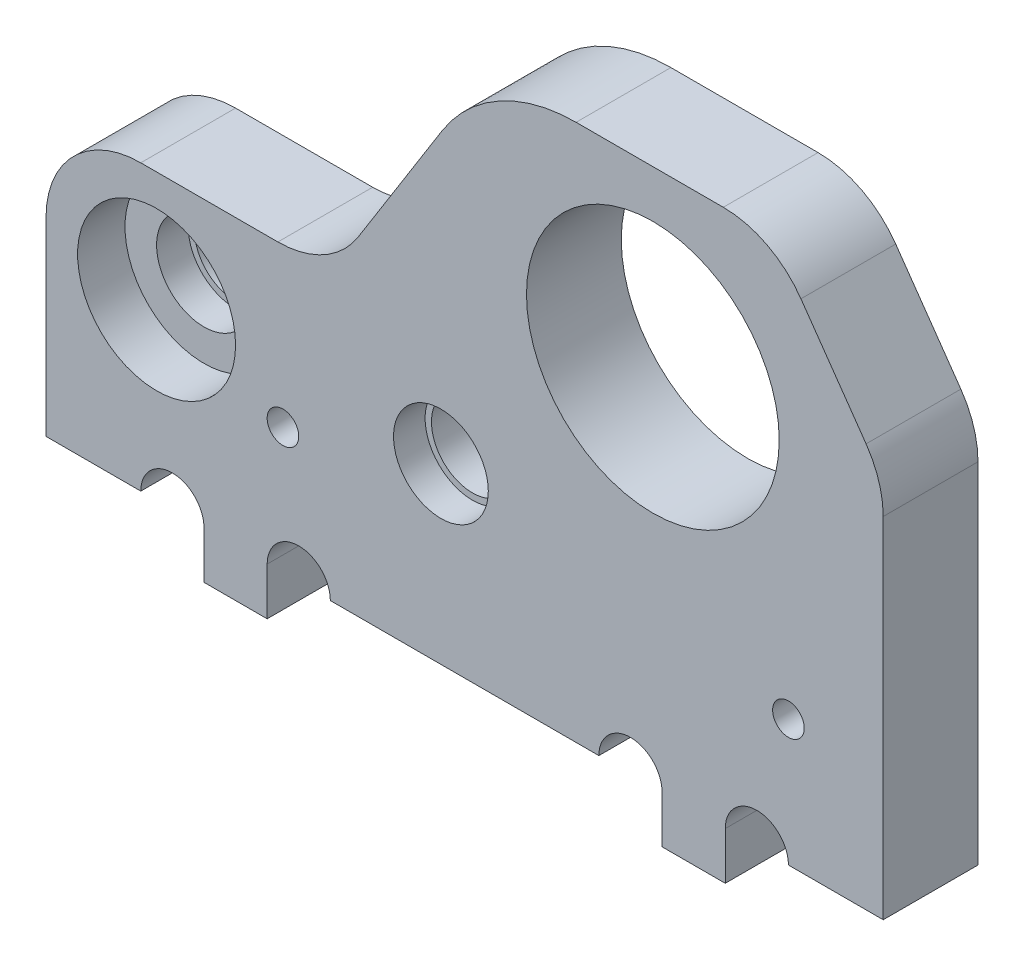
from build123d import *

# Parameters (mm, degrees)
SKETCH1_W                            = 26.5
SKETCH1_H                            = 6
BOSS_EXTRUDE1_DEPTH                  = 17
SKETCH2_R                            = 1.5
CUT_EXTRUDE1_DEPTH                   = 1
SKETCH3_R                            = 1.3
CUT_EXTRUDE2_DEPTH                   = 32.878676259
SKETCH4_R                            = 4
CUT_EXTRUDE3_DEPTH                   = 33.050741021
SKETCH5_R                            = 2.5
CUT_EXTRUDE4_DEPTH                   = 1.5
SKETCH6_R                            = 1.5
CUT_EXTRUDE8_DEPTH                   = 1
SKETCH7_R                            = 1.3
CUT_EXTRUDE9_DEPTH                   = 32.678068123
CUT_EXTRUDE10_START                  = -1
SKETCH8_R                            = 2.5
CUT_EXTRUDE10_DEPTH                  = 1
CUT_EXTRUDE11_START                  = -1
SKETCH9_R                            = 1.5
CUT_EXTRUDE11_DEPTH                  = 1
SKETCH10_R                           = 5.5
SKETCH10_R_2                         = 4
BOSS_EXTRUDE2_DEPTH                  = 3.5
SKETCH11_R                           = 3
SKETCH11_R_2                         = 1.3
BOSS_EXTRUDE4_DEPTH                  = 2
CUT_EXTRUDE12_START                  = -1
SKETCH12_R                           = 1.5
CUT_EXTRUDE12_DEPTH                  = 1
SKETCH17_W                           = 2
SKETCH17_H                           = 6
BOSS_EXTRUDE6_DEPTH                  = 1.5
SKETCH18_R                           = 1
CUT_EXTRUDE17_DEPTH                  = 33.050741021
CHAMFER2_SIZE                        = 5
CHAMFER2_SIZE2                       = 3.5
FILLET11_R                           = 3
BOSS_EXTRUDE7_DEPTH                  = 2
CUT_EXTRUDE19_DEPTH                  = 33.050741021
FILLET13_R                           = 5
FILLET14_R                           = 3
FILLET15_R                           = 3
SKIZZE1_R                            = 0.5
SCHNITT_LINEAR_AUSTRAGEN1_DEPTH      = 33.050741021
SCHNITT_LINEAR_AUSTRAGEN2_DEPTH      = 31.409702399
SCHNITT_LINEAR_AUSTRAGEN2_DEPTH_BACK = 31.409702399
SKIZZE2_W                            = 26.5
SKIZZE2_H                            = 6.5


with BuildPart() as part:
    # Sketch1 → Boss-Extrude1 (new body)
    with BuildSketch(Plane(origin=(0, 0, 0), x_dir=(1, 0, 0), z_dir=(0, 1, 0))):
        with Locations((13.25, 3)):
            Rectangle(SKETCH1_W, SKETCH1_H)
    extrude(amount=BOSS_EXTRUDE1_DEPTH)

    # Sketch2 → Cut-Extrude1 (cut)
    with BuildSketch(Plane.XY):
        with Locations((12.5, 5.5)):
            Circle(SKETCH2_R)
    extrude(amount=-CUT_EXTRUDE1_DEPTH, mode=Mode.SUBTRACT)

    # Sketch3 → Cut-Extrude2 (cut, through all)
    with BuildSketch(Plane.XY.offset(-1)):
        with Locations((12.5, 5.5)):
            Circle(SKETCH3_R)
    extrude(amount=-CUT_EXTRUDE2_DEPTH, mode=Mode.SUBTRACT)

    # Sketch4 → Cut-Extrude3 (cut, through all)
    with BuildSketch(Plane.XY):
        with Locations((19.208203932, 11.5)):
            Circle(SKETCH4_R)
    extrude(amount=-CUT_EXTRUDE3_DEPTH, mode=Mode.SUBTRACT)

    # Sketch5 → Cut-Extrude4 (cut)
    with BuildSketch(Plane.XY):
        with Locations((3.5, 5.5)):
            Circle(SKETCH5_R)
    extrude(amount=-CUT_EXTRUDE4_DEPTH, mode=Mode.SUBTRACT)

    # Sketch6 → Cut-Extrude8 (cut)
    with BuildSketch(Plane.XY.offset(-1.5)):
        with Locations((3.5, 5.5)):
            Circle(SKETCH6_R)
    extrude(amount=-CUT_EXTRUDE8_DEPTH, mode=Mode.SUBTRACT)

    # Sketch7 → Cut-Extrude9 (cut, through all)
    with BuildSketch(Plane.XY.offset(-2.5)):
        with Locations((3.5, 5.5)):
            Circle(SKETCH7_R)
    extrude(amount=-CUT_EXTRUDE9_DEPTH, mode=Mode.SUBTRACT)

    # Sketch8 → Cut-Extrude10 (cut)
    with BuildSketch(Plane(origin=(0, 0, -6), x_dir=(-1, 0, 0), z_dir=(0, 0, -1)).offset(CUT_EXTRUDE10_START)):
        with Locations(Location((-3.5, 5.5, 0), (0, 0, 180))):
            Circle(SKETCH8_R)
    extrude(amount=CUT_EXTRUDE10_DEPTH, mode=Mode.SUBTRACT)

    # Sketch9 → Cut-Extrude11 (cut)
    with BuildSketch(Plane(origin=(0, 0, -5), x_dir=(-1, 0, 0), z_dir=(0, 0, -1)).offset(CUT_EXTRUDE11_START)):
        with Locations(Location((-3.5, 5.5, 0), (0, 0, 180))):
            Circle(SKETCH9_R)
    extrude(amount=CUT_EXTRUDE11_DEPTH, mode=Mode.SUBTRACT)

    # Sketch10 → Boss-Extrude2 (add)
    with BuildSketch(Plane(origin=(0, 0, -6), x_dir=(-1, 0, 0), z_dir=(0, 0, -1))):
        with Locations(Location((-19.208203932, 11.5, 0), (0, 0, 90))):
            Circle(SKETCH10_R)
        with Locations(Location((-19.208203932, 11.5, 0), (0, 0, 180))):
            Circle(SKETCH10_R_2, mode=Mode.SUBTRACT)
    extrude(amount=BOSS_EXTRUDE2_DEPTH)

    # Sketch11 → Boss-Extrude4 (add)
    with BuildSketch(Plane(origin=(0, 0, -6), x_dir=(-1, 0, 0), z_dir=(0, 0, -1))):
        with Locations(Location((-12.5, 5.5, 0), (0, 0, 180))):
            Circle(SKETCH11_R)
        with Locations(Location((-12.5, 5.5, 0), (0, 0, 180))):
            Circle(SKETCH11_R_2, mode=Mode.SUBTRACT)
    extrude(amount=BOSS_EXTRUDE4_DEPTH)

    # Sketch12 → Cut-Extrude12 (cut)
    with BuildSketch(Plane(origin=(0, 0, -8), x_dir=(-1, 0, 0), z_dir=(0, 0, -1)).offset(CUT_EXTRUDE12_START)):
        with Locations(Location((-12.5, 5.5, 0), (0, 0, 180))):
            Circle(SKETCH12_R)
    extrude(amount=CUT_EXTRUDE12_DEPTH, mode=Mode.SUBTRACT)

    # Sketch17 → Boss-Extrude6 (add)
    with BuildSketch(Plane.XZ):
        with Locations((6, -3)):
            Rectangle(SKETCH17_W, SKETCH17_H)
        with Locations((20.5, -3)):
            Rectangle(SKETCH17_W, SKETCH17_H)
    extrude(amount=BOSS_EXTRUDE6_DEPTH)

    # Sketch18 → Cut-Extrude17 (cut, through all)
    with BuildSketch(Plane(origin=(0, 0, -6), x_dir=(-1, 0, 0), z_dir=(0, 0, -1))):
        with Locations((-22.5, 0)):
            Circle(SKETCH18_R)
        with Locations((-18.5, 0)):
            Circle(SKETCH18_R)
        with Locations((-8, 0)):
            Circle(SKETCH18_R)
        with Locations((-4, 0)):
            Circle(SKETCH18_R)
    extrude(amount=-CUT_EXTRUDE17_DEPTH, mode=Mode.SUBTRACT)

    # Chamfer2
    chamfer2_edges = [part.edges().sort_by_distance(p)[0] for p in [
        (26.5, 17, -3),
    ]]
    chamfer2_side = [part.faces().sort_by_distance(p)[0] for p in [
        (26.5, 8.5, -3),
    ]]
    chamfer(chamfer2_edges, length=CHAMFER2_SIZE, length2=CHAMFER2_SIZE2, reference=chamfer2_side[0])

    # Fillet11
    fillet11_edges = [part.edges().sort_by_distance(p)[0] for p in [
        (23, 17, -3),
        (26.5, 12, -3),
    ]]
    fillet(fillet11_edges, radius=FILLET11_R)

    # Sketch19 → Boss-Extrude7 (add)
    with BuildSketch(Plane(origin=(0, 0, -6), x_dir=(-1, 0, 0), z_dir=(0, 0, -1))):
        with BuildLine():
            Line((-14.547099294, 14.419606745), (-9.957579288, 7.09251277))
            ThreePointArc((-9.957579288, 7.09251277), (-14.736067977, 7.5), (-13.800160725, 2.796376119))
            Line((-13.800160725, 2.796376119), (-21.591831928, 6.543356218))
            ThreePointArc((-21.591831928, 6.543356218), (-15.108745974, 7.833333333), (-14.547099294, 14.419606745))
        make_face()
    extrude(amount=BOSS_EXTRUDE7_DEPTH)

    # Sketch20 → Cut-Extrude19 (cut, through all)
    with BuildSketch(Plane(origin=(0, 0, -6), x_dir=(-1, 0, 0), z_dir=(0, 0, -1))):
        Polygon((0, 17), (-14.011012575, 17), (-9, 9), (0, 9), align=None)
    extrude(amount=-CUT_EXTRUDE19_DEPTH, mode=Mode.SUBTRACT)

    # Fillet13
    fillet13_edges = [part.edges().sort_by_distance(p)[0] for p in [
        (14.011012575, 17, -3),
    ]]
    fillet(fillet13_edges, radius=FILLET13_R)

    # Fillet14
    fillet14_edges = [part.edges().sort_by_distance(p)[0] for p in [
        (9, 9, -3),
    ]]
    fillet(fillet14_edges, radius=FILLET14_R)

    # Fillet15
    fillet15_edges = [part.edges().sort_by_distance(p)[0] for p in [
        (0, 9, -3),
    ]]
    fillet(fillet15_edges, radius=FILLET15_R)

    # Skizze1 → Schnitt-Linear austragen1 (cut, through all)
    with BuildSketch(Plane(origin=(0, 0, -6), x_dir=(-1, 0, 0), z_dir=(0, 0, -1))):
        with Locations((-23.5, 4)):
            Circle(SKIZZE1_R)
        with Locations((-7.5, 4)):
            Circle(SKIZZE1_R)
    extrude(amount=-SCHNITT_LINEAR_AUSTRAGEN1_DEPTH, mode=Mode.SUBTRACT)

    # Skizze2 → Schnitt-Linear austragen2 (cut, two sides: drawn at the far end of the back side and taken through both)
    with BuildSketch(Plane(origin=(0, 5.5, 0), x_dir=(1, 0, 0), z_dir=(0, 1, 0)).offset(-SCHNITT_LINEAR_AUSTRAGEN2_DEPTH_BACK)):
        with Locations((13.25, 6.25)):
            Rectangle(SKIZZE2_W, SKIZZE2_H)
    extrude(amount=SCHNITT_LINEAR_AUSTRAGEN2_DEPTH + SCHNITT_LINEAR_AUSTRAGEN2_DEPTH_BACK, mode=Mode.SUBTRACT)


solid = part.part
